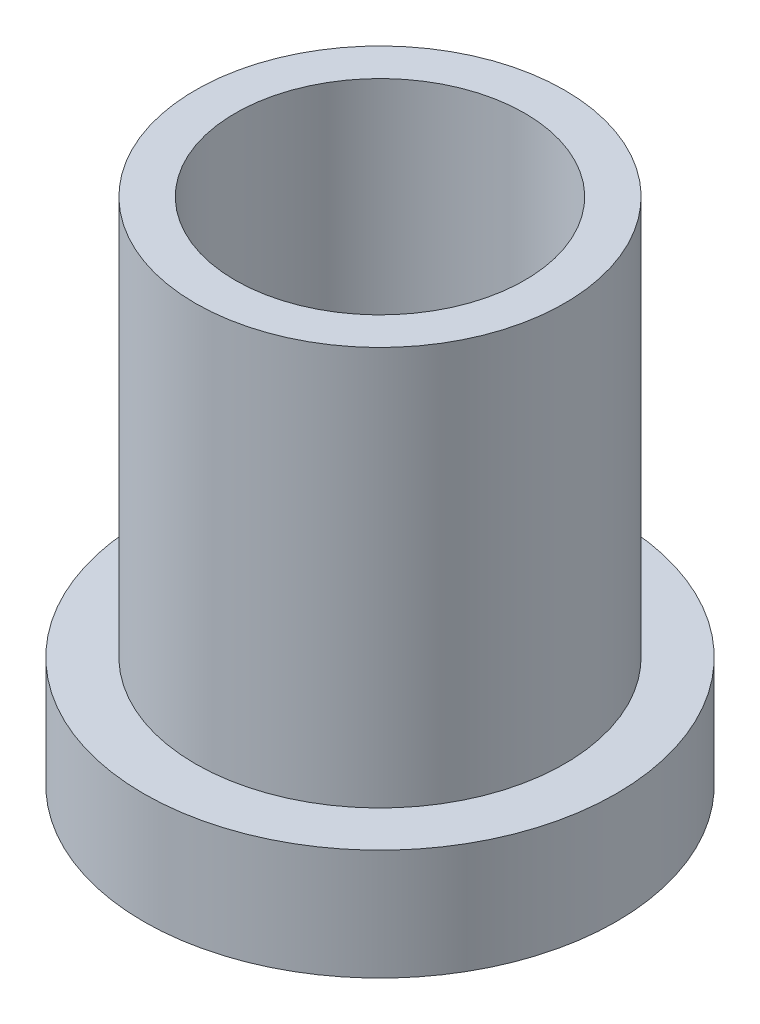
from build123d import *

# Parameters (mm, degrees)
SKETCH1_R           = 3.175
SKETCH1_R_2         = 2.4892
BOSS_EXTRUDE1_DEPTH = 6.858
SKETCH2_R           = 4.064
BOSS_EXTRUDE2_DEPTH = 1.905
SKETCH3_R           = 2.4892
CUT_EXTRUDE1_DEPTH  = 11.479616453


with BuildPart() as part:
    # Sketch1 → Boss-Extrude1 (new body)
    with BuildSketch(Plane(origin=(0, 0, 0), x_dir=(1, 0, 0), z_dir=(0, 1, 0))):
        with Locations(Location((0, 0, 0), (0, 0, 270))):
            Circle(SKETCH1_R)
        with Locations(Location((0, 0, 0), (0, 0, 270))):
            Circle(SKETCH1_R_2, mode=Mode.SUBTRACT)
    extrude(amount=BOSS_EXTRUDE1_DEPTH)

    # Sketch2 → Boss-Extrude2 (add)
    with BuildSketch(Plane.XZ):
        with Locations(Location((0, 0, 0), (0, 0, 90))):
            Circle(SKETCH2_R)
    extrude(amount=BOSS_EXTRUDE2_DEPTH)

    # Sketch3 → Cut-Extrude1 (cut, through all)
    with BuildSketch(Plane.XZ.offset(1.905)):
        with Locations(Location((0, 0, 0), (0, 0, 270))):
            Circle(SKETCH3_R)
    extrude(amount=-CUT_EXTRUDE1_DEPTH, mode=Mode.SUBTRACT)


solid = part.part
